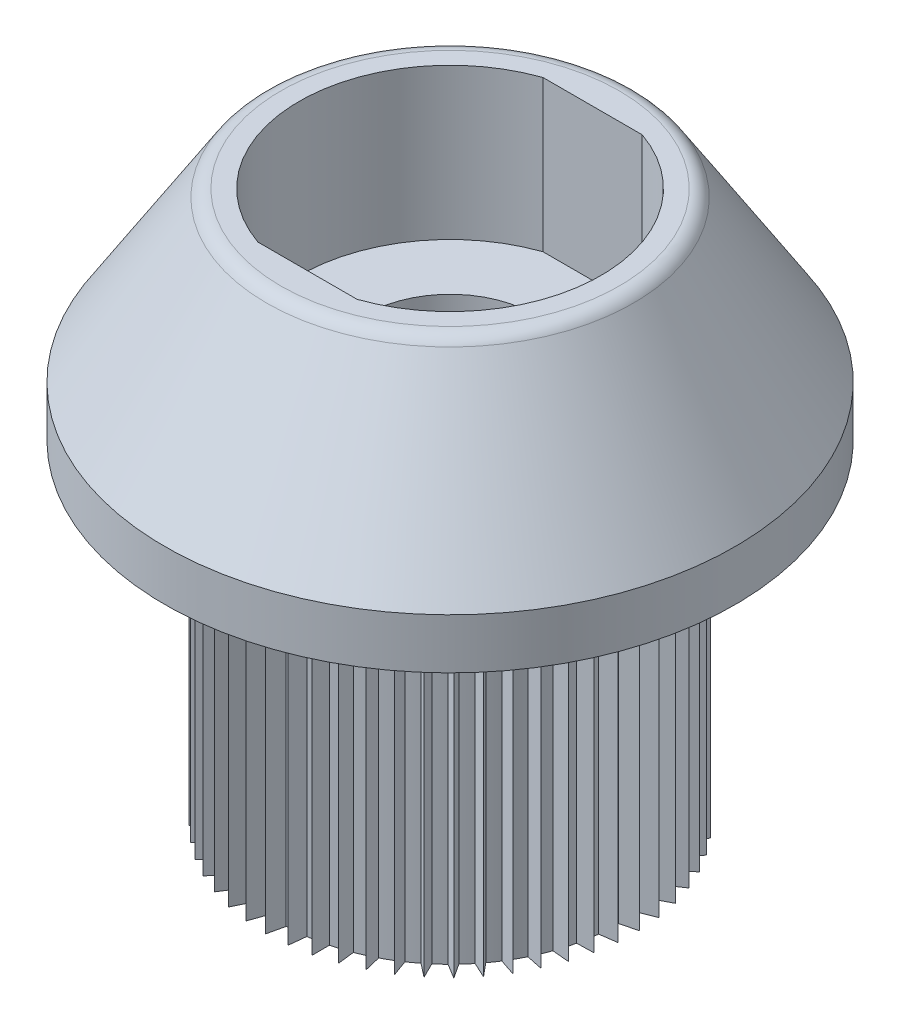
from build123d import *

# Parameters (mm, degrees)
EXTRUDE_1_DEPTH          = 10
PATTERN_CIRCULAR_1_COUNT = 55
EXTRUDE_START            = -6
EXTRUDE_2_DEPTH          = 6
SKETCH_4_R               = 7
CUT_EXTRUDE_1_DEPTH      = 0.5
FILLET_2_R               = 0.5


with BuildPart() as part:
    # Эскиз1 → Повернуть1 (revolve)
    with BuildSketch(Plane.XY, mode=Mode.PRIVATE) as revolve_1_sk:
        Polygon((-5, 17), (-4.5, 17), (-4.5, 12), (-2.5, 12), (-2.5, 0), (-5, 0), (-5, 10), (-8.5, 10), (-8.5, 11.5), align=None)
    revolve(revolve_1_sk.sketch.rotate(Axis((0, -50, 0), (0, 1, 0)), 270), axis=Axis((0, -50, 0), (0, 1, 0)))

    # Эскиз2 → Бобышка-Вытянуть1 (add)
    with BuildSketch(Plane.XZ):
        Polygon((-0.25, 4.399667297), (0, 5.5), (0.25, 4.399667297), align=None)
    extrude_1 = extrude(amount=-EXTRUDE_1_DEPTH)

    # Круговой массив1: Бобышка-Вытянуть1 ×55 about axis
    pattern_circular_1_axis = Axis((0, 0, 0), (0, 1, 0))
    for i in range(1, PATTERN_CIRCULAR_1_COUNT):
        add(extrude_1.rotate(pattern_circular_1_axis, i * 360 / PATTERN_CIRCULAR_1_COUNT))

    # Эскиз3 → Бобышка-Вытянуть2 (add)
    with BuildSketch(Plane(origin=(0, 17, 0), x_dir=(1, 0, 0), z_dir=(0, 1, 0)).offset(EXTRUDE_START)):
        with BuildLine():
            Line((-1.479019946, 4.25), (1.479019946, 4.25))
            ThreePointArc((1.479019946, 4.25), (0, 4.5), (-1.479019946, 4.25))
        make_face()
        with BuildLine():
            Line((-1.479019946, -4.25), (1.479019946, -4.25))
            ThreePointArc((1.479019946, -4.25), (0, -4.5), (-1.479019946, -4.25))
        make_face()
    extrude(amount=EXTRUDE_2_DEPTH)

    # Эскиз4 → Вырез-Вытянуть1 (cut)
    with BuildSketch(Plane(origin=(0, 17, 0), x_dir=(1, 0, 0), z_dir=(0, 1, 0))):
        Circle(SKETCH_4_R)
    extrude(amount=-CUT_EXTRUDE_1_DEPTH, mode=Mode.SUBTRACT)

    # Скругление2
    fillet_2_edges = [part.edges().sort_by_distance(p)[0] for p in [
        (0, 16.5, 5.318181818),
    ]]
    fillet(fillet_2_edges, radius=FILLET_2_R)


solid = part.part
